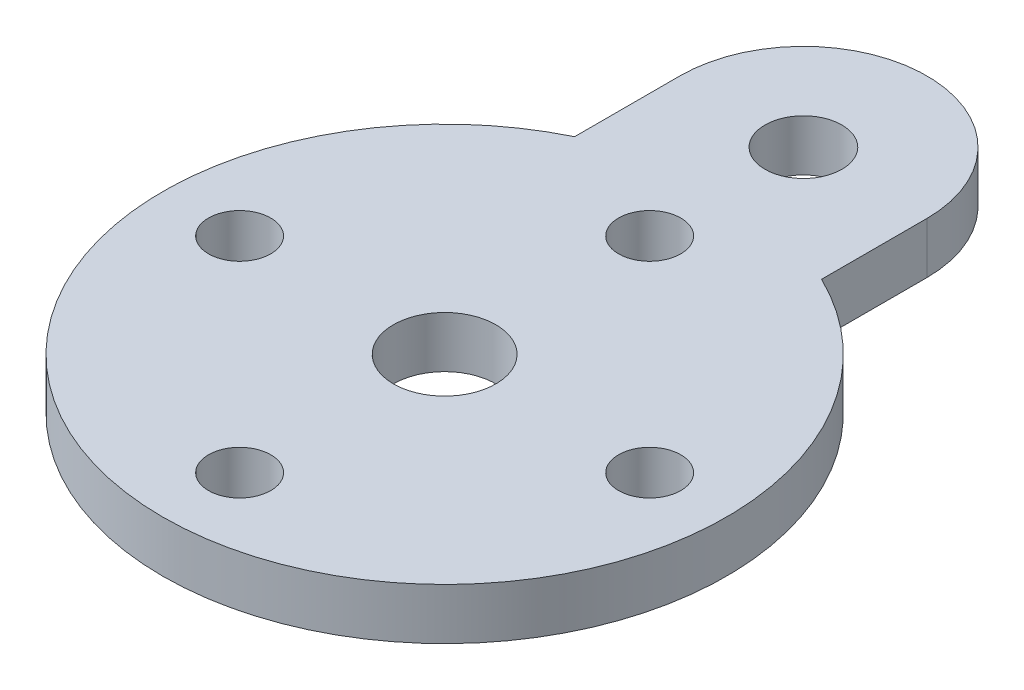
from build123d import *

# Parameters (mm, degrees)
SKETCH1_R           = 1.213402711
SKETCH1_R_2         = 2
SKETCH1_R_3         = 1.5
BOSS_EXTRUDE1_DEPTH = 2


with BuildPart() as part:
    # Sketch1 → Boss-Extrude1 (new body)
    with BuildSketch(Plane(origin=(0, 0, 0), x_dir=(1, 0, 0), z_dir=(0, 1, 0))):
        with BuildLine():
            Line((-4.818106402, 14), (-4.818106402, 9.888672848))
            ThreePointArc((-4.818106402, 9.888672848), (0, -11), (4.818106402, 9.888672848))
            Line((4.818106402, 9.888672848), (4.818106402, 14))
            ThreePointArc((4.818106402, 14), (0, 18.818106402), (-4.818106402, 14))
        make_face()
        with Locations(Location((0, 8, 0), (0, 0, 270))):
            Circle(SKETCH1_R, mode=Mode.SUBTRACT)
        with Locations(Location((8, 0, 0), (0, 0, 270))):
            Circle(SKETCH1_R, mode=Mode.SUBTRACT)
        with Locations(Location((0, -8, 0), (0, 0, 270))):
            Circle(SKETCH1_R, mode=Mode.SUBTRACT)
        with Locations(Location((-8, 0, 0), (0, 0, 270))):
            Circle(SKETCH1_R, mode=Mode.SUBTRACT)
        with Locations(Location((0, 0, 0), (0, 0, 270))):
            Circle(SKETCH1_R_2, mode=Mode.SUBTRACT)
        with Locations(Location((0, 14, 0), (0, 0, 270))):
            Circle(SKETCH1_R_3, mode=Mode.SUBTRACT)
    extrude(amount=BOSS_EXTRUDE1_DEPTH)


solid = part.part
